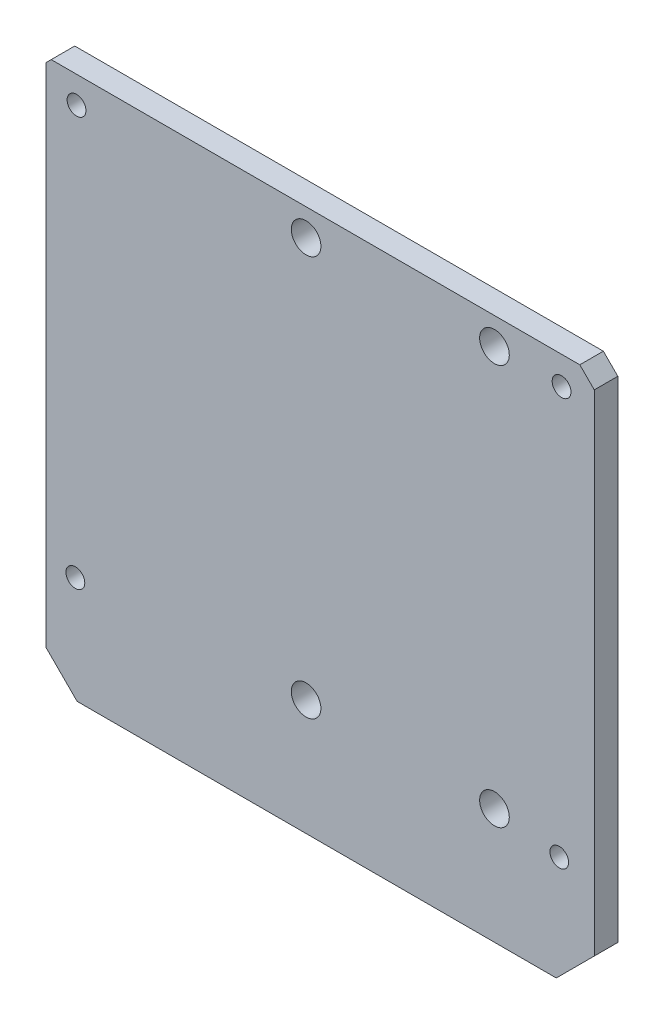
from build123d import *

# Parameters (mm, degrees)
SKETCH1_R           = 4.000005254
SKETCH1_R_2         = 6.295294196
SKETCH1_R_3         = 6.298818985
SKETCH1_R_4         = 4.000046515
SKETCH1_R_5         = 3.96227159
SKETCH1_R_6         = 6.298583834
SKETCH1_R_7         = 6.289262296
SKETCH1_R_8         = 4.000026217
BOSS_EXTRUDE1_DEPTH = 10
SCALE1_SCALE        = 0.254310345


with BuildPart() as part:
    # Sketch1 → Boss-Extrude1 (new body)
    with BuildSketch(Plane.XY):
        Polygon((4033.100097656, -3054.507080078), (4035.240234375, -3052.350097656), (4259.751464844, -3052.350097656), (4265.899902344, -3058.498535156), (4265.899902344, -3266.751464844), (4249.751464844, -3282.899902344), (4046.248535156, -3282.899902344), (4033.100097656, -3269.751464844), align=None)
        with Locations((4046.000008659, -3063.7500542)):
            Circle(SKETCH1_R, mode=Mode.SUBTRACT)
        with Locations((4143.496433826, -3063.770149106)):
            Circle(SKETCH1_R_2, mode=Mode.SUBTRACT)
        with Locations((4223.5, -3063.750049197)):
            Circle(SKETCH1_R_3, mode=Mode.SUBTRACT)
        with Locations((4252.000063875, -3064.25000712)):
            Circle(SKETCH1_R_4, mode=Mode.SUBTRACT)
        with Locations((4251.021334492, -3237.795441039)):
            Circle(SKETCH1_R_5, mode=Mode.SUBTRACT)
        with Locations((4223.5, -3233.750415039)):
            Circle(SKETCH1_R_6, mode=Mode.SUBTRACT)
        with Locations((4143.493016467, -3233.75871347)):
            Circle(SKETCH1_R_7, mode=Mode.SUBTRACT)
        with Locations((4045.500040954, -3237.749996915)):
            Circle(SKETCH1_R_8, mode=Mode.SUBTRACT)
    extrude(amount=BOSS_EXTRUDE1_DEPTH)


with BuildPart() as part_1:
    # Scale1: scaled about (4149.056874209, -3167.460792727, 5)
    add(part.part.scale(SCALE1_SCALE).moved(Location((3093.90878982, -2361.942746301, 3.728448276))))


solid = part_1.part
